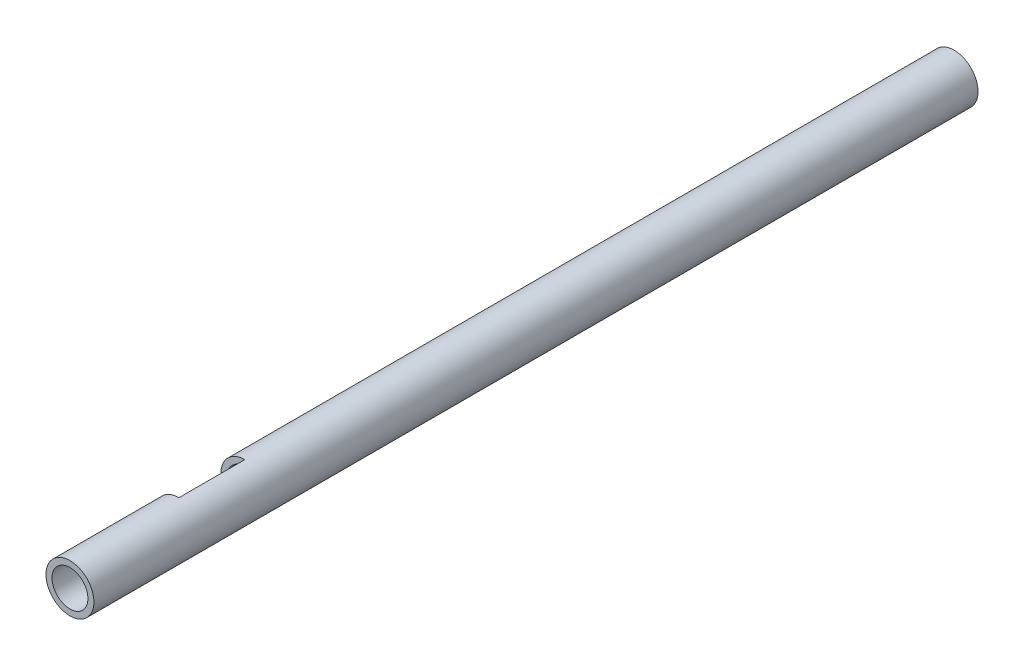
from build123d import *

# Parameters (mm, degrees)
SKETCH1_W               = 738
SKETCH1_H               = 5
CUT_EXTRUDE1_DEPTH      = 739.541806535
CUT_EXTRUDE1_DEPTH_BACK = 739.541806535
SKETCH2_W               = 37.714751534
SKETCH2_H               = 55


with BuildPart() as part:
    # Sketch1 → Revolve1 (revolve)
    with BuildSketch(Plane(origin=(0, 0, 0), x_dir=(0, 0, -1), z_dir=(1, 0, 0)), mode=Mode.PRIVATE) as revolve1_sk:
        with Locations((-369, 17.5)):
            Rectangle(SKETCH1_W, SKETCH1_H)
    revolve(revolve1_sk.sketch.rotate(Axis((0, 0, 0), (0, 0, 1)), 90), axis=Axis((0, 0, 0), (0, 0, 1)))

    # Sketch2 → Cut-Extrude1 (cut, two sides: drawn at the far end of the back side and taken through both)
    with BuildSketch(Plane(origin=(0, 0, 0), x_dir=(1, 0, 0), z_dir=(0, 1, 0)).offset(-CUT_EXTRUDE1_DEPTH_BACK)):
        with Locations((-18.857375767, -619.5)):
            Rectangle(SKETCH2_W, SKETCH2_H)
    extrude(amount=CUT_EXTRUDE1_DEPTH + CUT_EXTRUDE1_DEPTH_BACK, mode=Mode.SUBTRACT)


solid = part.part
